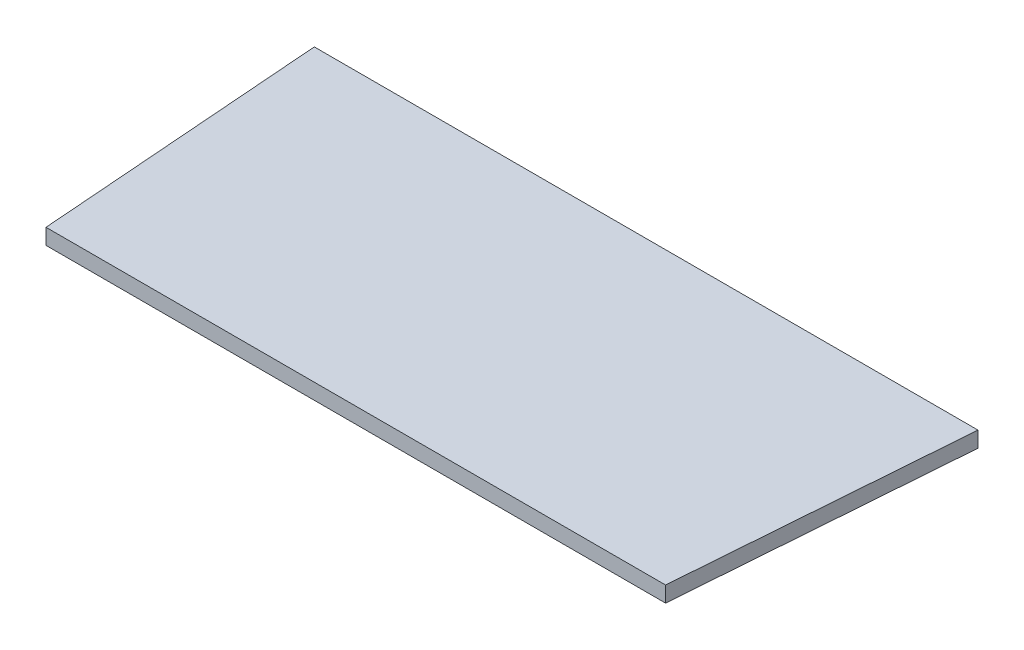
from build123d import *

# Parameters (mm, degrees)
EXTRUDE_1_DEPTH = 26.5


with BuildPart() as part:
    # Эскиз1 → Бобышка-Вытянуть1 (new, symmetric)
    with BuildSketch(Plane(origin=(0, 0, 0), x_dir=(1, 0, 0), z_dir=(0, 1, 0))):
        Polygon((-1120, 490), (1120, 490), (1045.5, -490), (-1045.5, -490), align=None)
    extrude(amount=EXTRUDE_1_DEPTH, both=True)


solid = part.part
